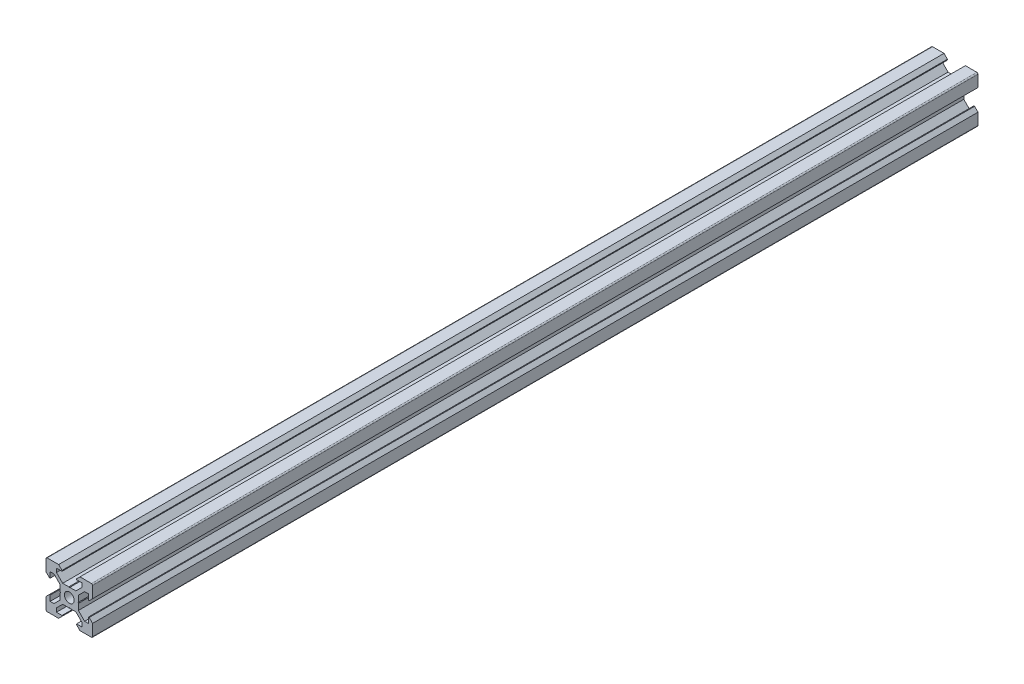
from build123d import *

# Parameters (mm, degrees)
SKETCH1_R           = 2.1
BOSS_EXTRUDE1_DEPTH = 380


with BuildPart() as part:
    # Sketch1 → Boss-Extrude1 (new body)
    with BuildSketch(Plane.XY):
        with BuildLine():
            Line((4.58, -10), (9.5, -10))
            ThreePointArc((9.5, -10), (9.853553391, -9.853553391), (10, -9.5))
            Line((10, -9.5), (10, -4.58))
            Line((10, -4.58), (8.545, -3.125))
            Line((8.545, -3.125), (8.2, -3.125))
            Line((8.2, -3.125), (8.2, -5.5))
            Line((8.2, -5.5), (6.560660172, -5.5))
            Line((6.560660172, -5.5), (3.9, -2.839339828))
            Line((3.9, -2.839339828), (3.9, -0.21))
            Line((3.9, -0.21), (3.69, 0))
            Line((3.69, 0), (3.9, 0.21))
            Line((3.9, 0.21), (3.9, 2.839339828))
            Line((3.9, 2.839339828), (6.560660172, 5.5))
            Line((6.560660172, 5.5), (8.2, 5.5))
            Line((8.2, 5.5), (8.2, 3.125))
            Line((8.2, 3.125), (8.545, 3.125))
            Line((8.545, 3.125), (10, 4.58))
            Line((10, 4.58), (10, 9.5))
            ThreePointArc((10, 9.5), (9.853553391, 9.853553391), (9.5, 10))
            Line((9.5, 10), (4.58, 10))
            Line((4.58, 10), (3.125, 8.545))
            Line((3.125, 8.545), (3.125, 8.2))
            Line((3.125, 8.2), (5.5, 8.2))
            Line((5.5, 8.2), (5.5, 6.560660172))
            Line((5.5, 6.560660172), (2.839339828, 3.9))
            Line((2.839339828, 3.9), (0.21, 3.9))
            Line((0.21, 3.9), (0, 3.69))
            Line((0, 3.69), (-0.21, 3.9))
            Line((-0.21, 3.9), (-2.839339828, 3.9))
            Line((-2.839339828, 3.9), (-5.5, 6.560660172))
            Line((-5.5, 6.560660172), (-5.5, 8.2))
            Line((-5.5, 8.2), (-3.125, 8.2))
            Line((-3.125, 8.2), (-3.125, 8.545))
            Line((-3.125, 8.545), (-4.58, 10))
            Line((-4.58, 10), (-9.5, 10))
            ThreePointArc((-9.5, 10), (-9.853553391, 9.853553391), (-10, 9.5))
            Line((-10, 9.5), (-10, 4.58))
            Line((-10, 4.58), (-8.545, 3.125))
            Line((-8.545, 3.125), (-8.2, 3.125))
            Line((-8.2, 3.125), (-8.2, 5.5))
            Line((-8.2, 5.5), (-6.560660172, 5.5))
            Line((-6.560660172, 5.5), (-3.9, 2.839339828))
            Line((-3.9, 2.839339828), (-3.9, 0.21))
            Line((-3.9, 0.21), (-3.69, 0))
            Line((-3.69, 0), (-3.9, -0.21))
            Line((-3.9, -0.21), (-3.9, -2.839339828))
            Line((-3.9, -2.839339828), (-6.560660172, -5.5))
            Line((-6.560660172, -5.5), (-8.2, -5.5))
            Line((-8.2, -5.5), (-8.2, -3.125))
            Line((-8.2, -3.125), (-8.545, -3.125))
            Line((-8.545, -3.125), (-10, -4.58))
            Line((-10, -4.58), (-10, -9.5))
            ThreePointArc((-10, -9.5), (-9.853553391, -9.853553391), (-9.5, -10))
            Line((-9.5, -10), (-4.58, -10))
            Line((-4.58, -10), (-3.125, -8.545))
            Line((-3.125, -8.545), (-3.125, -8.2))
            Line((-3.125, -8.2), (-5.5, -8.2))
            Line((-5.5, -8.2), (-5.5, -6.560660172))
            Line((-5.5, -6.560660172), (-2.839339828, -3.9))
            Line((-2.839339828, -3.9), (-0.21, -3.9))
            Line((-0.21, -3.9), (0, -3.69))
            Line((0, -3.69), (0.21, -3.9))
            Line((0.21, -3.9), (2.839339828, -3.9))
            Line((2.839339828, -3.9), (5.5, -6.560660172))
            Line((5.5, -6.560660172), (5.5, -8.2))
            Line((5.5, -8.2), (3.125, -8.2))
            Line((3.125, -8.2), (3.125, -8.545))
            Line((3.125, -8.545), (4.58, -10))
        make_face()
        Circle(SKETCH1_R, mode=Mode.SUBTRACT)
    extrude(amount=BOSS_EXTRUDE1_DEPTH)


solid = part.part
